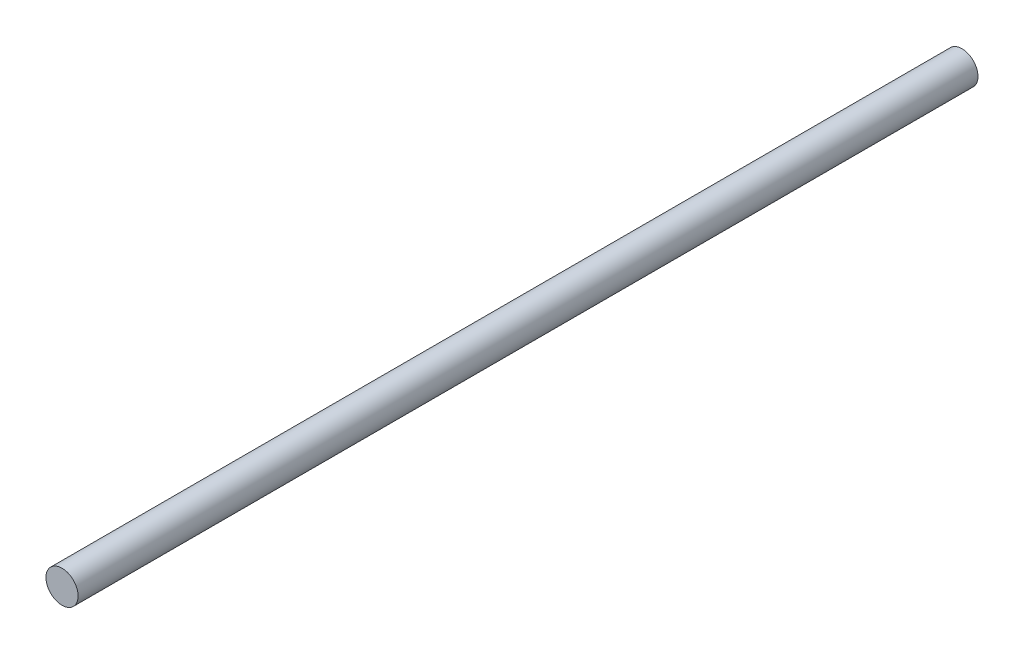
from build123d import *

# Parameters (mm, degrees)
SKETCH_1_R      = 12.5
EXTRUDE_1_DEPTH = 700


with BuildPart() as part:
    # 草图1 → 凸台-拉伸1 (new body)
    with BuildSketch(Plane.XY):
        Circle(SKETCH_1_R)
    extrude(amount=EXTRUDE_1_DEPTH)


solid = part.part
